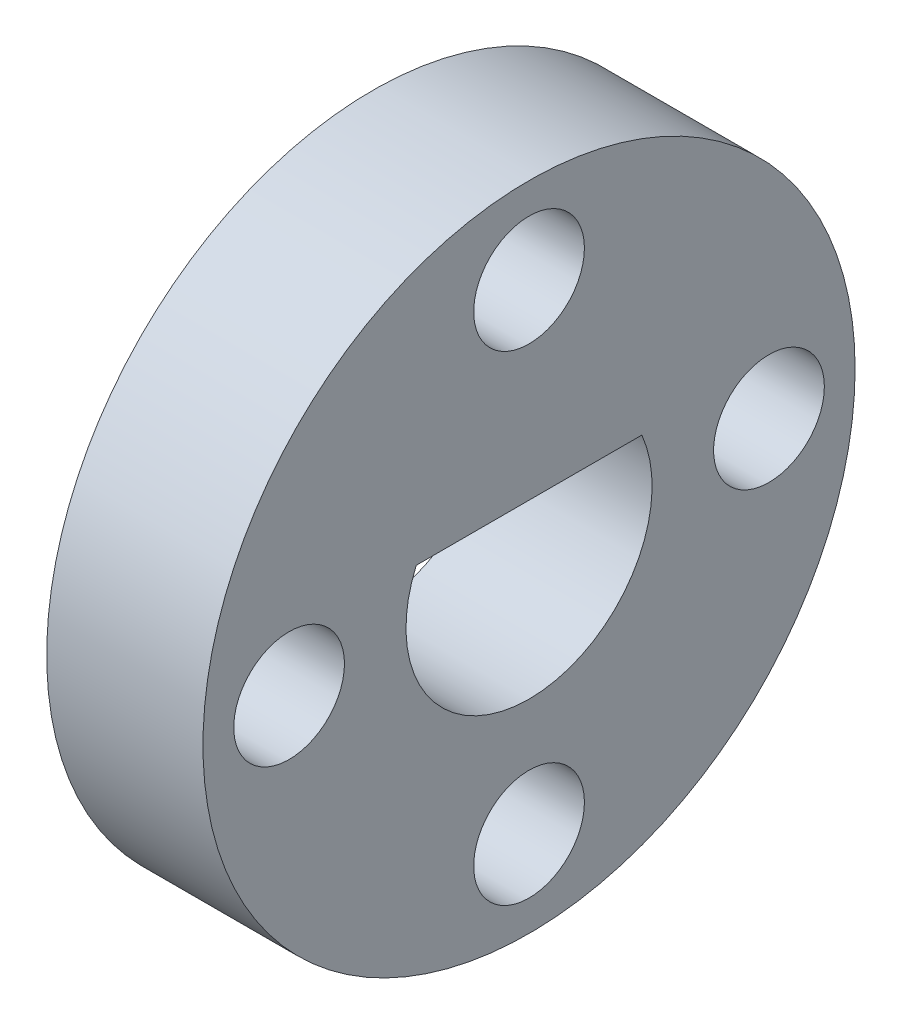
from build123d import *

# Parameters (mm, degrees)
SKETCH1_R           = 13.25
SKETCH1_R_2         = 2.25
BOSS_EXTRUDE1_DEPTH = 6.35


with BuildPart() as part:
    # Sketch1 → Boss-Extrude1 (new body)
    with BuildSketch(Plane(origin=(0, 0, 0), x_dir=(0, 0, -1), z_dir=(1, 0, 0))):
        Circle(SKETCH1_R)
        with Locations((-9.75, 0)):
            Circle(SKETCH1_R_2, mode=Mode.SUBTRACT)
        with Locations((0, 9.75)):
            Circle(SKETCH1_R_2, mode=Mode.SUBTRACT)
        with Locations((9.75, 0)):
            Circle(SKETCH1_R_2, mode=Mode.SUBTRACT)
        with Locations((0, -9.75)):
            Circle(SKETCH1_R_2, mode=Mode.SUBTRACT)
        with BuildLine():
            Line((-4.582575695, 2), (4.582575695, 2))
            ThreePointArc((4.582575695, 2), (0, -5), (-4.582575695, 2))
        make_face(mode=Mode.SUBTRACT)
    extrude(amount=BOSS_EXTRUDE1_DEPTH)


solid = part.part
